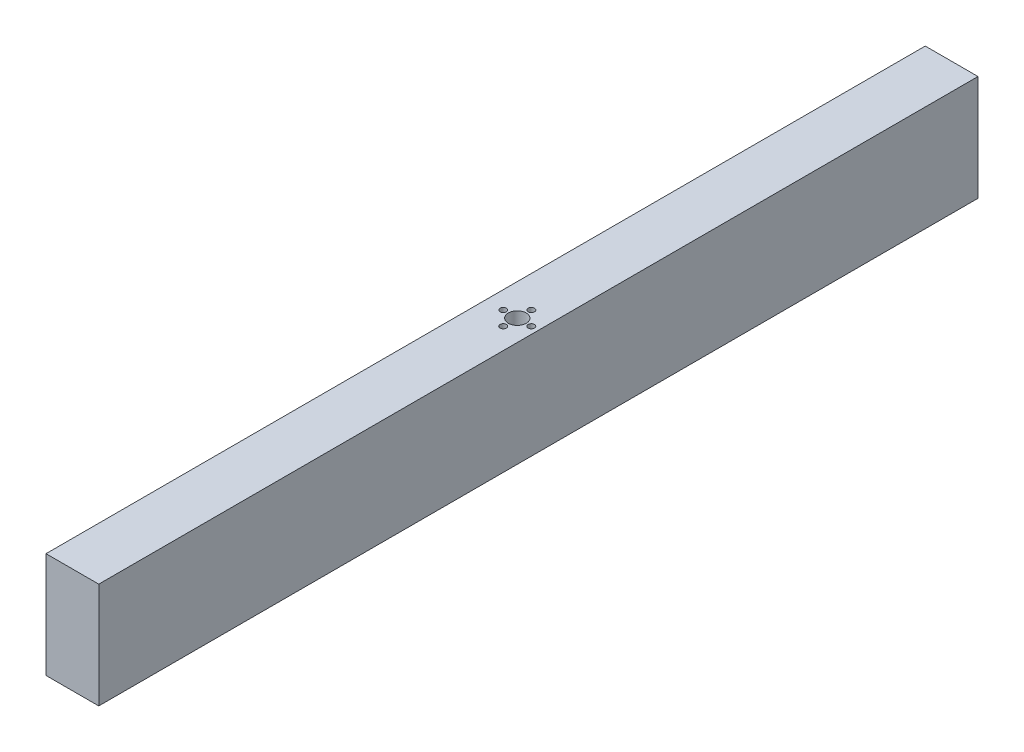
from build123d import *

# Parameters (mm, degrees)
SKETCH1_W           = 30
SKETCH1_H           = 60
BOSS_EXTRUDE1_DEPTH = 250
SKETCH3_R           = 4.5
SKETCH3_R_2         = 1.8
CUT_EXTRUDE1_DEPTH  = 258.536405194
SKETCH4_R           = 5.1
CUT_EXTRUDE2_DEPTH  = 10


with BuildPart() as part:
    # Sketch1 → Boss-Extrude1 (new, symmetric)
    with BuildSketch(Plane.XY):
        Rectangle(SKETCH1_W, SKETCH1_H)
    extrude(amount=BOSS_EXTRUDE1_DEPTH, both=True)

    # Sketch3 → Cut-Extrude1 (cut, through all)
    with BuildSketch(Plane.XZ.offset(30)):
        with Locations(Location((3, 0, 0), (0, 0, 270))):
            Circle(SKETCH3_R)
        with Locations(Location((11, 0, 0), (0, 0, 270))):
            Circle(SKETCH3_R_2)
        with Locations(Location((3, -8, 0), (0, 0, 270))):
            Circle(SKETCH3_R_2)
        with Locations(Location((-5, 0, 0), (0, 0, 270))):
            Circle(SKETCH3_R_2)
        with Locations(Location((3, 8, 0), (0, 0, 270))):
            Circle(SKETCH3_R_2)
    extrude(amount=-CUT_EXTRUDE1_DEPTH, mode=Mode.SUBTRACT)

    # Sketch4 → Cut-Extrude2 (cut)
    with BuildSketch(Plane.XZ.offset(30)):
        with Locations(Location((3, 0, 0), (0, 0, 270))):
            Circle(SKETCH4_R)
    cut_extrude2 = extrude(amount=-CUT_EXTRUDE2_DEPTH, mode=Mode.SUBTRACT)

    # Mirror1: Cut-Extrude2 across plane
    add(cut_extrude2.mirror(Plane.ZX), mode=Mode.SUBTRACT)


solid = part.part
